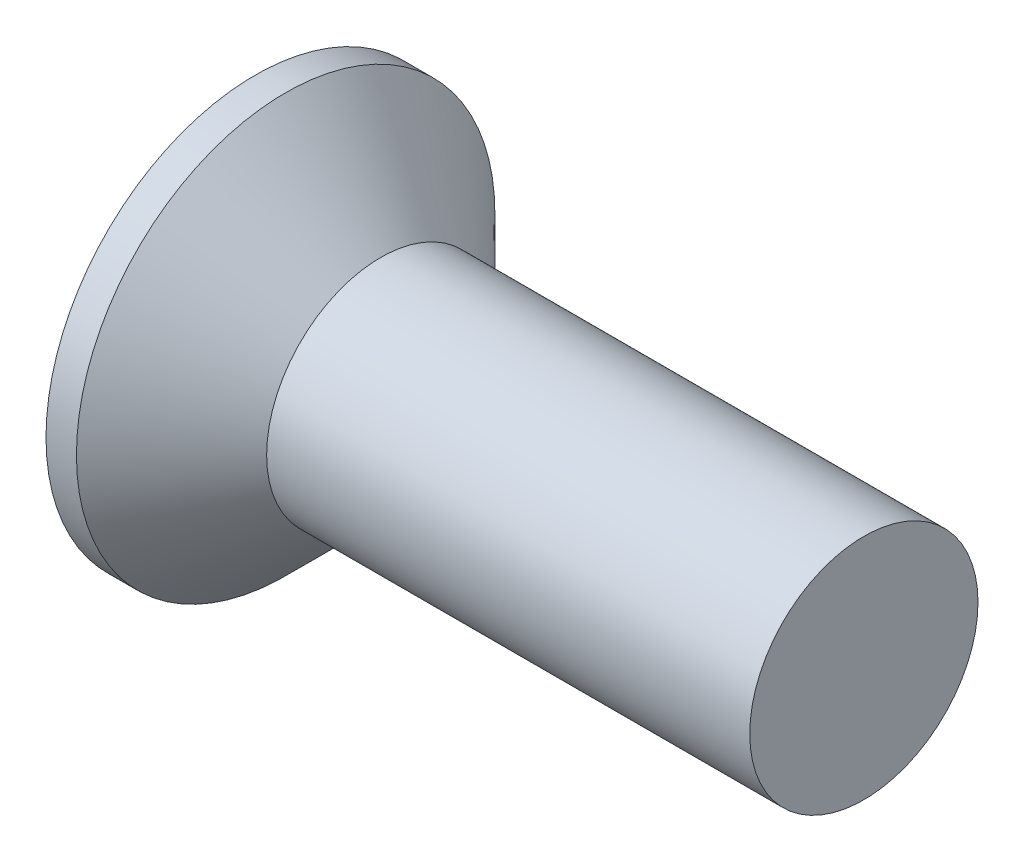
from build123d import *


with BuildPart() as part:
    # Esquisse1 → Révolution1 (revolve)
    with BuildSketch(Plane.XY, mode=Mode.PRIVATE) as r_volution1_sk:
        Polygon((0, 0), (8, 0), (8, 1.5), (1.65, 1.5), (0.4, 2.75), (0, 2.75), align=None)
    revolve(r_volution1_sk.sketch.rotate(Axis((0, 0, 0), (1, 0, 0)), 90), axis=Axis((0, 0, 0), (1, 0, 0)))


solid = part.part
